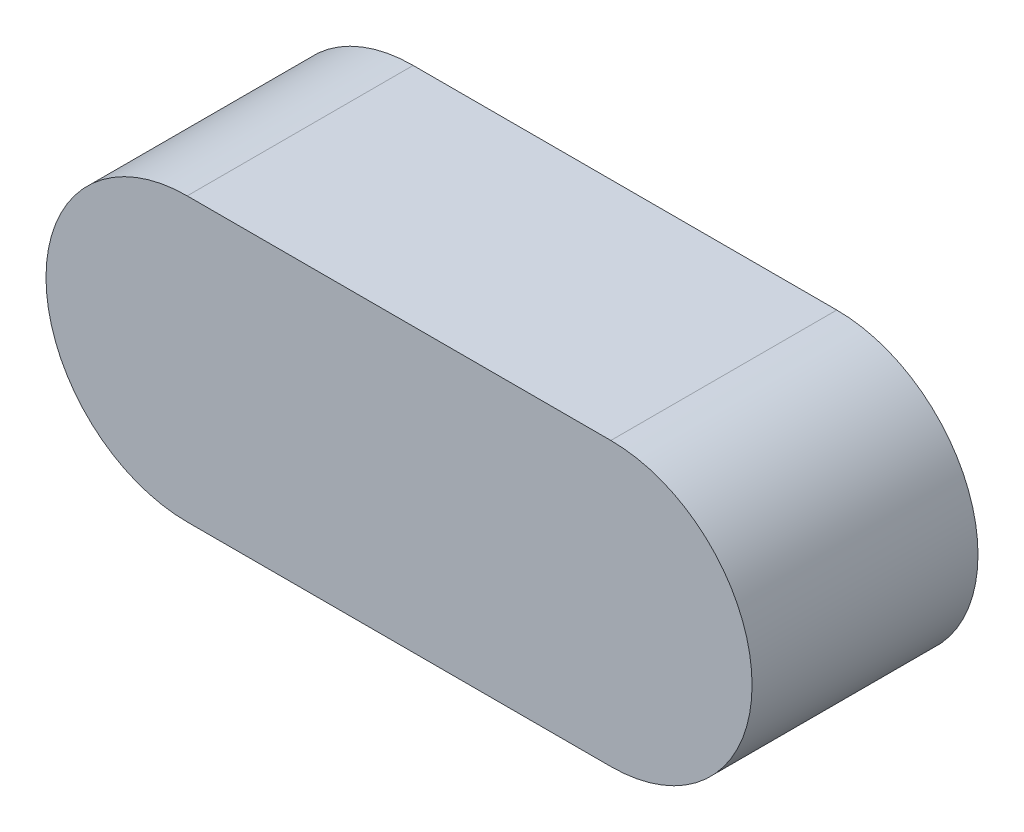
from build123d import *

# Parameters (mm, degrees)
ESTRUSIONE_ESTRUSIONE1_DEPTH = 8


with BuildPart() as part:
    # Schizzo1 → Estrusione-Estrusione1 (new body)
    with BuildSketch(Plane.XY):
        with BuildLine():
            Line((9.599265933, 5), (24.599265933, 5))
            ThreePointArc((24.599265933, 5), (29.599265933, 0), (24.599265933, -5))
            Line((24.599265933, -5), (9.599265933, -5))
            ThreePointArc((9.599265933, -5), (4.599265933, 0), (9.599265933, 5))
        make_face()
    extrude(amount=ESTRUSIONE_ESTRUSIONE1_DEPTH)


solid = part.part
